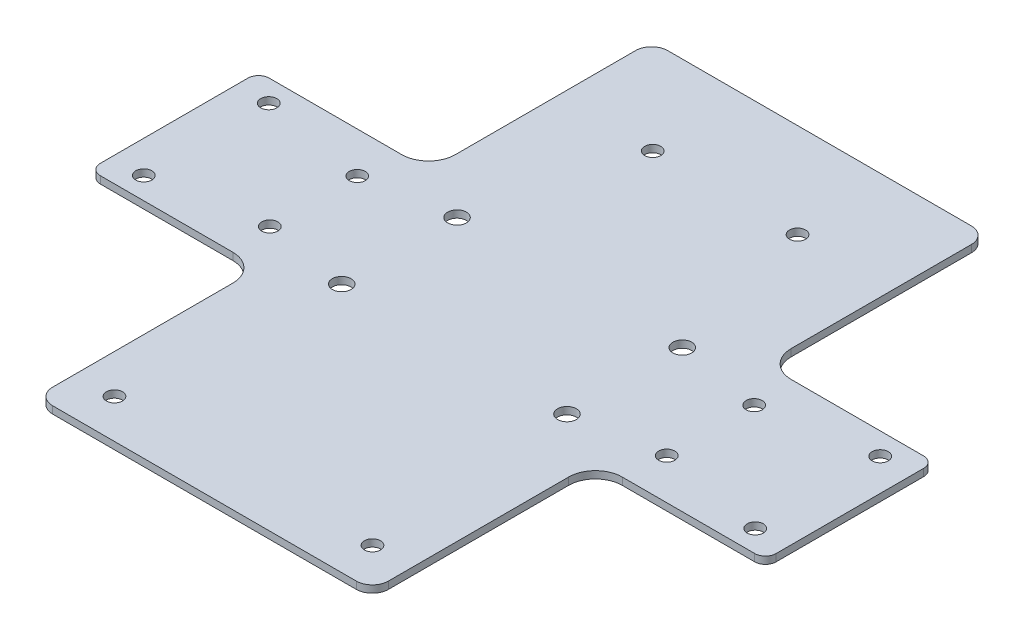
from build123d import *

# Parameters (mm, degrees)
SKETCH3_R           = 1.5
BOSS_EXTRUDE1_DEPTH = 1.35
FILLET1_R           = 2
FILLET2_R           = 3
FILLET3_R           = 5
SKETCH4_R           = 1.75
CUT_EXTRUDE1_DEPTH  = 86.197993521


with BuildPart() as part:
    # Sketch3 → Boss-Extrude1 (new body)
    with BuildSketch(Plane(origin=(0, 0, 0), x_dir=(1, 0, 0), z_dir=(0, 1, 0))):
        Polygon((31.305, 15.75), (31.305, 57.34), (-31.305, 57.34), (-31.305, 15.75), (-63, 15.75), (-63, -15.75), (-31.305, -15.75), (-31.305, -57.34), (31.305, -57.34), (31.305, -15.75), (63, -15.75), (63, 15.75), align=None)
        with Locations(Location((-57, 11.65, 0), (0, 0, 90))):
            Circle(SKETCH3_R, mode=Mode.SUBTRACT)
        with Locations(Location((-57, -11.65, 0), (0, 0, 90))):
            Circle(SKETCH3_R, mode=Mode.SUBTRACT)
        with Locations(Location((-37, -8.15, 0), (0, 0, 90))):
            Circle(SKETCH3_R, mode=Mode.SUBTRACT)
        with Locations(Location((-37, 8.15, 0), (0, 0, 90))):
            Circle(SKETCH3_R, mode=Mode.SUBTRACT)
        with Locations(Location((37, 8.15, 0), (0, 0, 90))):
            Circle(SKETCH3_R, mode=Mode.SUBTRACT)
        with Locations(Location((57, 11.65, 0), (0, 0, 90))):
            Circle(SKETCH3_R, mode=Mode.SUBTRACT)
        with Locations(Location((57, -11.65, 0), (0, 0, 90))):
            Circle(SKETCH3_R, mode=Mode.SUBTRACT)
        with Locations(Location((37, -8.15, 0), (0, 0, 90))):
            Circle(SKETCH3_R, mode=Mode.SUBTRACT)
        with Locations(Location((-13.5, 39.735100189, 0), (0, 0, 90))):
            Circle(SKETCH3_R, mode=Mode.SUBTRACT)
        with Locations(Location((13.5, 39.735100189, 0), (0, 0, 90))):
            Circle(SKETCH3_R, mode=Mode.SUBTRACT)
        with Locations(Location((-24.05, -50.064899811, 0), (0, 0, 90))):
            Circle(SKETCH3_R, mode=Mode.SUBTRACT)
        with Locations(Location((24.05, -50.064899811, 0), (0, 0, 90))):
            Circle(SKETCH3_R, mode=Mode.SUBTRACT)
    extrude(amount=BOSS_EXTRUDE1_DEPTH)

    # Fillet1
    fillet1_edges = [part.edges().sort_by_distance(p)[0] for p in [
        (63, 0.675, -15.75),
        (63, 0.675, 15.75),
        (-63, 0.675, 15.75),
        (-63, 0.675, -15.75),
    ]]
    fillet(fillet1_edges, radius=FILLET1_R)

    # Fillet2
    fillet2_edges = [part.edges().sort_by_distance(p)[0] for p in [
        (-31.305, 0.675, -57.34),
        (31.305, 0.675, -57.34),
        (31.305, 0.675, 57.34),
        (-31.305, 0.675, 57.34),
    ]]
    fillet(fillet2_edges, radius=FILLET2_R)

    # Fillet3
    fillet3_edges = [part.edges().sort_by_distance(p)[0] for p in [
        (-31.305, 0.675, -15.75),
        (31.305, 0.675, -15.75),
        (31.305, 0.675, 15.75),
        (-31.305, 0.675, 15.75),
    ]]
    fillet(fillet3_edges, radius=FILLET3_R)

    # Sketch4 → Cut-Extrude1 (cut, through all)
    with BuildSketch(Plane(origin=(0, 1.35, 0), x_dir=(1, 0, 0), z_dir=(0, 1, 0))):
        with Locations(Location((-21, -10.75, 0), (0, 0, 270))):
            Circle(SKETCH4_R)
        with Locations(Location((21, -10.75, 0), (0, 0, 270))):
            Circle(SKETCH4_R)
        with Locations(Location((21, 10.75, 0), (0, 0, 270))):
            Circle(SKETCH4_R)
        with Locations(Location((-21, 10.75, 0), (0, 0, 270))):
            Circle(SKETCH4_R)
    extrude(amount=-CUT_EXTRUDE1_DEPTH, mode=Mode.SUBTRACT)


solid = part.part
